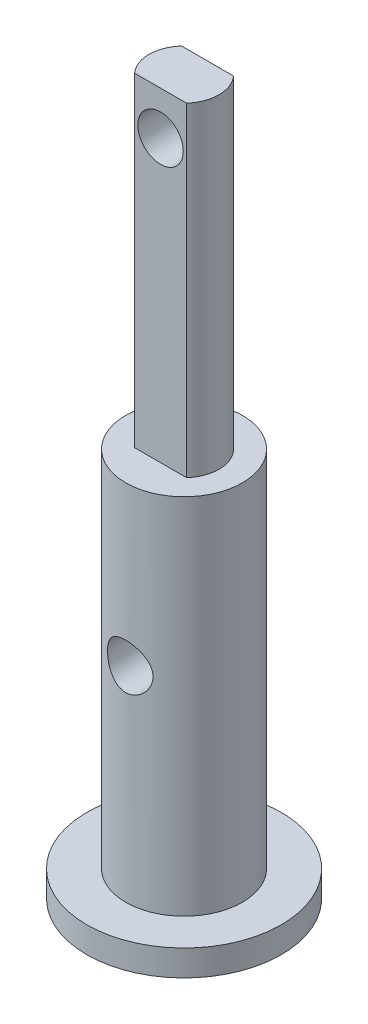
from build123d import *

# Parameters (mm, degrees)
SKETCH1_R               = 7.5
SKETCH1_R_2             = 4.5
BOSS_EXTRUDE1_DEPTH     = 2
SKETCH1_2_R             = 4.5
BOSS_EXTRUDE2_DEPTH     = 55
CUT_EXTRUDE1_START      = -25
SKETCH2_R               = 4.5
CUT_EXTRUDE1_DEPTH      = 25
CUT_EXTRUDE2_DEPTH      = 25
CUT_EXTRUDE2_DEPTH_BACK = 25
SKETCH3_R               = 1.75


with BuildPart() as part:
    # Sketch1 → Boss-Extrude1 (new body)
    with BuildSketch(Plane(origin=(0, 0, 0), x_dir=(1, 0, 0), z_dir=(0, 1, 0))):
        Circle(SKETCH1_R)
        Circle(SKETCH1_R_2, mode=Mode.SUBTRACT)
    extrude(amount=BOSS_EXTRUDE1_DEPTH)

    # Sketch1<2> → Boss-Extrude2 (add)
    with BuildSketch(Plane(origin=(0, 0, 0), x_dir=(1, 0, 0), z_dir=(0, 1, 0))):
        Circle(SKETCH1_2_R)
    extrude(amount=BOSS_EXTRUDE2_DEPTH)

    # Sketch2 → Cut-Extrude1 (cut)
    with BuildSketch(Plane(origin=(0, 55, 0), x_dir=(1, 0, 0), z_dir=(0, 1, 0)).offset(CUT_EXTRUDE1_START)):
        Circle(SKETCH2_R)
        with BuildLine():
            Line((-2, 1.811376185), (2, 1.811376185))
            ThreePointArc((2, 1.811376185), (2.698348325, 0), (2, -1.811376185))
            Line((2, -1.811376185), (-2, -1.811376185))
            ThreePointArc((-2, -1.811376185), (-2.698348325, 0), (-2, 1.811376185))
        make_face(mode=Mode.SUBTRACT)
    extrude(amount=CUT_EXTRUDE1_DEPTH, mode=Mode.SUBTRACT)

    # Sketch3 → Cut-Extrude2 (cut, two sides: drawn at the far end of the back side and taken through both)
    with BuildSketch(Plane(origin=(0, 0, -1.811376185), x_dir=(-1, 0, 0), z_dir=(0, 0, -1)).offset(-CUT_EXTRUDE2_DEPTH_BACK)):
        with Locations((0, 51.660798888)):
            Circle(SKETCH3_R)
        with Locations((0, 17.75)):
            Circle(SKETCH3_R)
    extrude(amount=CUT_EXTRUDE2_DEPTH + CUT_EXTRUDE2_DEPTH_BACK, mode=Mode.SUBTRACT)


solid = part.part
